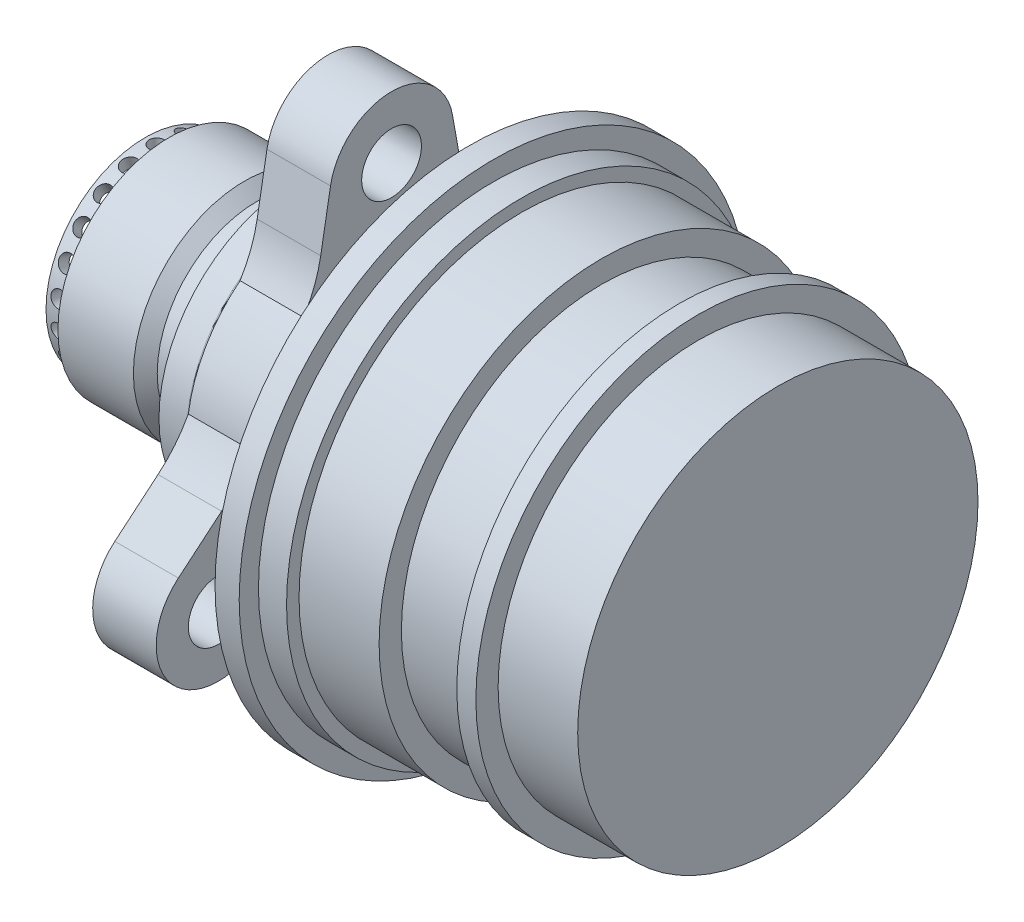
from build123d import *

# Parameters (mm, degrees)
CUT_EXTRUDE1_REACH      = 277.954
SKETCH2_R               = 5.974999988
CUT_EXTRUDE2_START      = -12.709612
CUT_EXTRUDE2_DEPTH      = 12.709613
CUT_EXTRUDE3_REACH      = 688.352
CUT_EXTRUDE3_END_RADIUS = 17.4625
SKETCH5_R               = 1.5875
CIRPATTERN1_COUNT       = 22


with BuildPart() as part:
    # Sketch1 → Revolve1 (revolve)
    with BuildSketch(Plane.XY, mode=Mode.PRIVATE) as revolve1_sk:
        with BuildLine():
            Line((-605.64049307, 247.65), (-589.64049307, 247.65))
            Line((-589.64049307, 247.65), (-589.64049307, 243.19992))
            Line((-589.64049307, 243.19992), (-574.11649307, 243.19992))
            Line((-574.11649307, 243.19992), (-574.11649307, 247.65))
            Line((-574.11649307, 247.65), (-570.30649307, 247.65))
            Line((-570.30649307, 247.65), (-570.30649307, 243.19992))
            Line((-570.30649307, 243.19992), (-554.40649307, 243.19992))
            Line((-554.40649307, 243.19992), (-554.40649307, 203.2))
            Line((-554.40649307, 203.2), (-616.07849307, 203.2))
            Line((-616.07849307, 203.2), (-616.07849307, 218.1225))
            Line((-616.07849307, 218.1225), (-616.07849307, 220.6625))
            Line((-616.07849307, 220.6625), (-618.61849307, 220.6625))
            Line((-618.61849307, 220.6625), (-680.81399307, 220.6625))
            Line((-680.81399307, 220.6625), (-680.81399307, 223.04375))
            Line((-680.81399307, 223.04375), (-676.05149307, 223.04375))
            Line((-676.05149307, 223.04375), (-676.05149307, 225.425))
            Line((-676.05149307, 225.425), (-660.97024307, 225.425))
            Line((-660.97024307, 225.425), (-658.58899307, 223.04375))
            Line((-658.58899307, 223.04375), (-655.41399307, 223.04375))
            ThreePointArc((-655.41399307, 223.04375), (-652.046397025, 224.438653955), (-650.65149307, 227.80625))
            Line((-650.65149307, 227.80625), (-650.65149307, 230.632))
            Line((-650.65149307, 230.632), (-645.09524307, 230.632))
            ThreePointArc((-645.09524307, 230.632), (-644.533977063, 230.864483992), (-644.30149307, 231.42575))
            Line((-644.30149307, 231.42575), (-644.30149307, 255.5875))
            Line((-644.30149307, 255.5875), (-631.60149307, 255.5875))
            Line((-631.60149307, 255.5875), (-631.60149307, 231.775))
            ThreePointArc((-631.60149307, 231.775), (-629.741621131, 227.284871939), (-625.25149307, 225.425))
            Line((-625.25149307, 225.425), (-622.42849307, 225.425))
            ThreePointArc((-622.42849307, 225.425), (-617.93836501, 227.284871939), (-616.07849307, 231.775))
            Line((-616.07849307, 231.775), (-616.07849307, 254))
            Line((-616.07849307, 254), (-611.25249307, 254))
            Line((-611.25249307, 254), (-611.25249307, 250.15))
            Line((-611.25249307, 250.15), (-605.64049307, 250.15))
            Line((-605.64049307, 250.15), (-605.64049307, 247.65))
        make_face()
    revolve(revolve1_sk.sketch.rotate(Axis((-616.07849307, 203.2, 0), (1, 0, 0)), 90), axis=Axis((-616.07849307, 203.2, 0), (1, 0, 0)))

    # Sketch2 → Cut-Extrude1 (cut, up to next)
    with BuildSketch(Plane.ZY.offset(644.30149307), mode=Mode.PRIVATE) as cut_extrude1_sk1:
        with Locations((0, 243.20000001)):
            Circle(SKETCH2_R)
    cut_extrude1_tool1 = extrude(cut_extrude1_sk1.sketch, amount=-CUT_EXTRUDE1_REACH, mode=Mode.PRIVATE) & part.part
    # Sketch2 → Cut-Extrude1 (cut, up to next)
    with BuildSketch(Plane.ZY.offset(644.30149307), mode=Mode.PRIVATE) as cut_extrude1_sk2:
        with Locations((-34.64101616, 183.199999995)):
            Circle(SKETCH2_R)
    cut_extrude1_tool2 = extrude(cut_extrude1_sk2.sketch, amount=-CUT_EXTRUDE1_REACH, mode=Mode.PRIVATE) & part.part
    # Sketch2 → Cut-Extrude1 (cut, up to next)
    with BuildSketch(Plane.ZY.offset(644.30149307), mode=Mode.PRIVATE) as cut_extrude1_sk3:
        with Locations((34.64101616, 183.199999995)):
            Circle(SKETCH2_R)
    cut_extrude1_tool3 = extrude(cut_extrude1_sk3.sketch, amount=-CUT_EXTRUDE1_REACH, mode=Mode.PRIVATE) & part.part
    add(cut_extrude1_tool1.solids().sort_by_distance((-644.301493, 243.2, 0))[0], mode=Mode.SUBTRACT)
    add(cut_extrude1_tool2.solids().sort_by_distance((-644.301493, 183.2, -34.641016))[0], mode=Mode.SUBTRACT)
    add(cut_extrude1_tool3.solids().sort_by_distance((-644.301493, 183.2, 34.641016))[0], mode=Mode.SUBTRACT)

    # Sketch4 → Cut-Extrude2 (cut)
    with BuildSketch(Plane.ZY.offset(644.30149307).offset(CUT_EXTRUDE2_START)):
        with BuildLine():
            ThreePointArc((-17.574852191, 225.286591714), (-15.439661153, 229.60316736), (-14.157576497, 234.245163161))
            Line((-14.157576497, 234.245163161), (-12.19930604, 245.351066801))
            ThreePointArc((-12.19930604, 245.351066801), (-7.962531704, 252.689375381), (-4.93e-07, 255.5875))
            ThreePointArc((-4.93e-07, 255.5875), (-45.368905968, 229.393749779), (-45.368905832, 177.006249986))
            ThreePointArc((-45.368905832, 177.006249986), (-46.840322193, 185.351066793), (-42.603547666, 192.689375539))
            Line((-42.603547666, 192.689375539), (-33.964688211, 199.938239322))
            ThreePointArc((-33.964688211, 199.938239322), (-30.58564425, 203.369555104), (-27.914975603, 207.376972609))
            ThreePointArc((-27.914975603, 207.376972609), (-24.444216541, 217.312875), (-17.574852191, 225.286591714))
        make_face()
        with BuildLine():
            ThreePointArc((45.368911504, 177.006259809), (45.368902886, 229.393755118), (-4.93e-07, 255.5875))
            ThreePointArc((-4.93e-07, 255.5875), (7.962531326, 252.689375698), (12.19930604, 245.351066801))
            Line((12.19930604, 245.351066801), (14.157576497, 234.245163161))
            ThreePointArc((14.157576497, 234.245163161), (15.439661153, 229.60316736), (17.574852191, 225.286591714))
            ThreePointArc((17.574852191, 225.286591714), (24.444216541, 217.312875), (27.914975603, 207.376972609))
            ThreePointArc((27.914975603, 207.376972609), (30.58564425, 203.369555104), (33.964688211, 199.938239322))
            Line((33.964688211, 199.938239322), (42.603547666, 192.689375539))
            ThreePointArc((42.603547666, 192.689375539), (46.840321208, 185.351072378), (45.368911504, 177.006259809))
        make_face()
        with BuildLine():
            ThreePointArc((-30.404241626, 171.55955766), (-38.877790669, 171.559557657), (-45.368905832, 177.006249986))
            ThreePointArc((-45.368905832, 177.006249986), (5.672e-06, 150.8125), (45.368911504, 177.006259809))
            ThreePointArc((45.368911504, 177.006259809), (38.877795999, 171.559559597), (30.404241626, 171.55955766))
            Line((30.404241626, 171.55955766), (19.807111714, 175.416597517))
            ThreePointArc((19.807111714, 175.416597517), (15.145983098, 176.627277536), (10.340123411, 176.936435678))
            ThreePointArc((10.340123411, 176.936435678), (0, 174.97425), (-10.340123411, 176.936435678))
            ThreePointArc((-10.340123411, 176.936435678), (-15.145983098, 176.627277536), (-19.807111714, 175.416597517))
            Line((-19.807111714, 175.416597517), (-30.404241626, 171.55955766))
        make_face()
    extrude(amount=CUT_EXTRUDE2_DEPTH, mode=Mode.SUBTRACT)

    # Cut-Extrude3: up to this cylinder (the profile starts outside it)
    cut_extrude3_end = Plane(origin=(-678.432743, 203.2, 0), z_dir=(-1, 0, 0)) * Cylinder(CUT_EXTRUDE3_END_RADIUS, 1412.629, mode=Mode.PRIVATE)
    # Sketch5 → Cut-Extrude3 (cut, up to the surface)
    with BuildSketch(Plane(origin=(0, 223.04375, 0), x_dir=(1, 0, 0), z_dir=(0, 1, 0)), mode=Mode.PRIVATE) as cut_extrude3_sk1:
        with Locations(Location((-678.43274307, 0, 0), (0, 0, 270))):
            Circle(SKETCH5_R)
    cut_extrude3_tool1 = extrude(cut_extrude3_sk1.sketch, amount=-CUT_EXTRUDE3_REACH, mode=Mode.PRIVATE) - cut_extrude3_end
    cut_extrude3 = cut_extrude3_tool1.solids().sort_by_distance((-678.432743, 223.04375, 0))[0]
    add(cut_extrude3, mode=Mode.SUBTRACT)

    # CirPattern1: Cut-Extrude3 ×22 about axis
    cirpattern1_axis = Axis((-616.07849307, 203.2, 0), (-1, 0, 0))
    for i in range(1, CIRPATTERN1_COUNT):
        add(cut_extrude3.rotate(cirpattern1_axis, i * 360 / CIRPATTERN1_COUNT), mode=Mode.SUBTRACT)


solid = part.part
